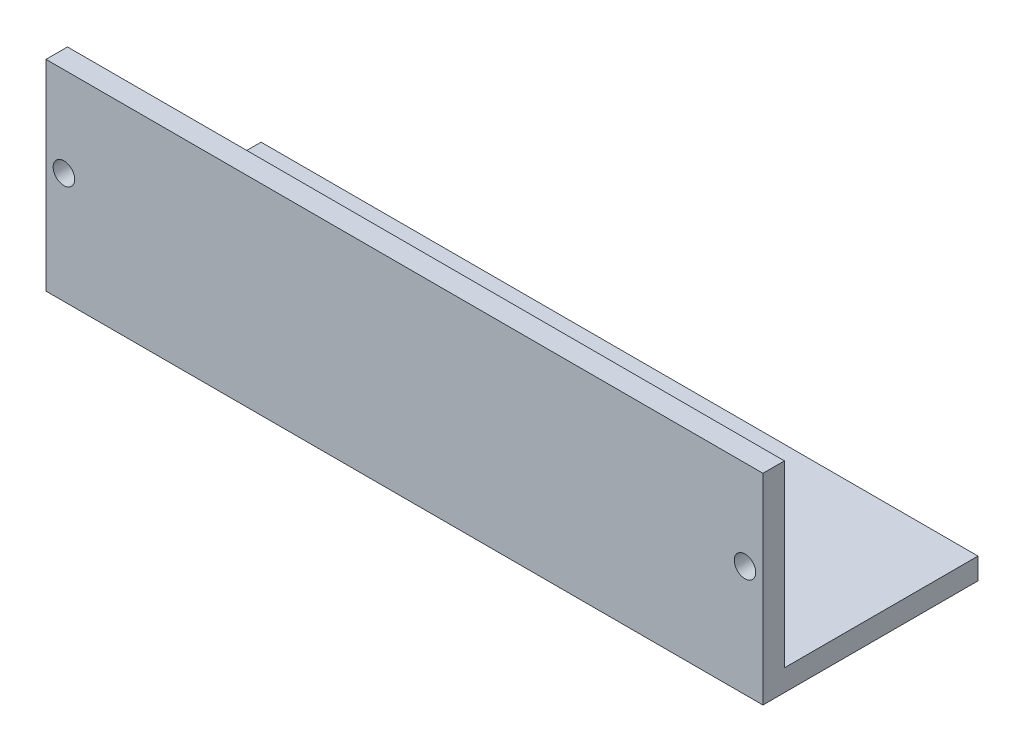
from build123d import *

# Parameters (mm, degrees)
SKETCH1_W           = 100
SKETCH1_H           = 25
SKETCH1_R           = 1.5
BOSS_EXTRUDE1_DEPTH = 3
SKETCH2_W           = 100
SKETCH2_H           = 30
BOSS_EXTRUDE2_DEPTH = 3
RIB1_REACH          = 60.9
SKETCH3_WALL_W      = 146.72650315
SKETCH3_WALL_H      = 40


with BuildPart() as part:
    # Sketch1 → Boss-Extrude1 (new body)
    with BuildSketch(Plane.XY):
        Rectangle(SKETCH1_W, SKETCH1_H)
        with Locations((-47.5, 0)):
            Circle(SKETCH1_R, mode=Mode.SUBTRACT)
        with Locations((47.5, 0)):
            Circle(SKETCH1_R, mode=Mode.SUBTRACT)
    extrude(amount=BOSS_EXTRUDE1_DEPTH)

    # Sketch2 → Boss-Extrude2 (add)
    with BuildSketch(Plane.XZ.offset(12.5)):
        with Locations((0, -12)):
            Rectangle(SKETCH2_W, SKETCH2_H)
    extrude(amount=BOSS_EXTRUDE2_DEPTH)

    # Sketch3 wall → Rib1 (add, up to next)
    with BuildSketch(Plane(origin=(0, 0, -5), x_dir=(0, -0.928476690885, -0.371390676354), z_dir=(0, 0.371390676354, -0.928476690885)), mode=Mode.PRIVATE) as rib1_sk1:
        Rectangle(SKETCH3_WALL_W, SKETCH3_WALL_H)
    rib1_tool1 = extrude(rib1_sk1.sketch, amount=-RIB1_REACH, mode=Mode.PRIVATE) - part.part
    add(rib1_tool1.solids().sort_by_distance((0, 0, -5))[0])


solid = part.part
